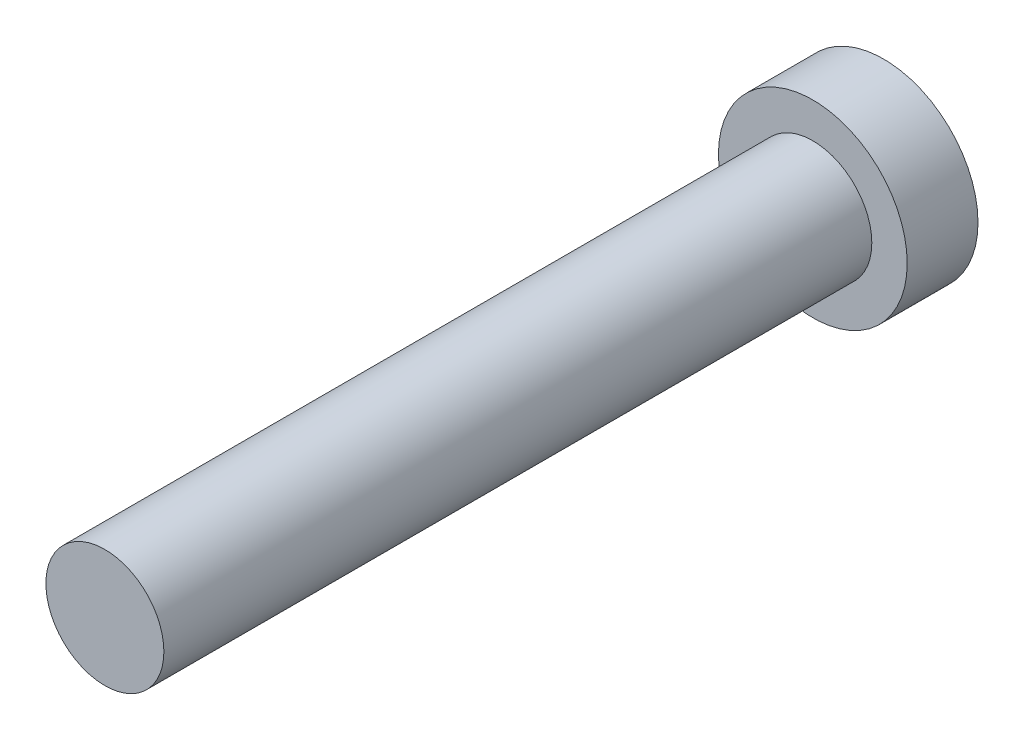
from build123d import *

# Parameters (mm, degrees)
SKETCH_1_R      = 4
EXTRUDE_1_DEPTH = 3
SKETCH_2_R      = 2.5
EXTRUDE_2_DEPTH = 30


with BuildPart() as part:
    # 草图1 → 凸台-拉伸1 (new body)
    with BuildSketch(Plane.XY):
        Circle(SKETCH_1_R)
    extrude(amount=EXTRUDE_1_DEPTH)

    # 草图2 → 凸台-拉伸2 (add)
    with BuildSketch(Plane.XY.offset(3)):
        Circle(SKETCH_2_R)
    extrude(amount=EXTRUDE_2_DEPTH)


solid = part.part
